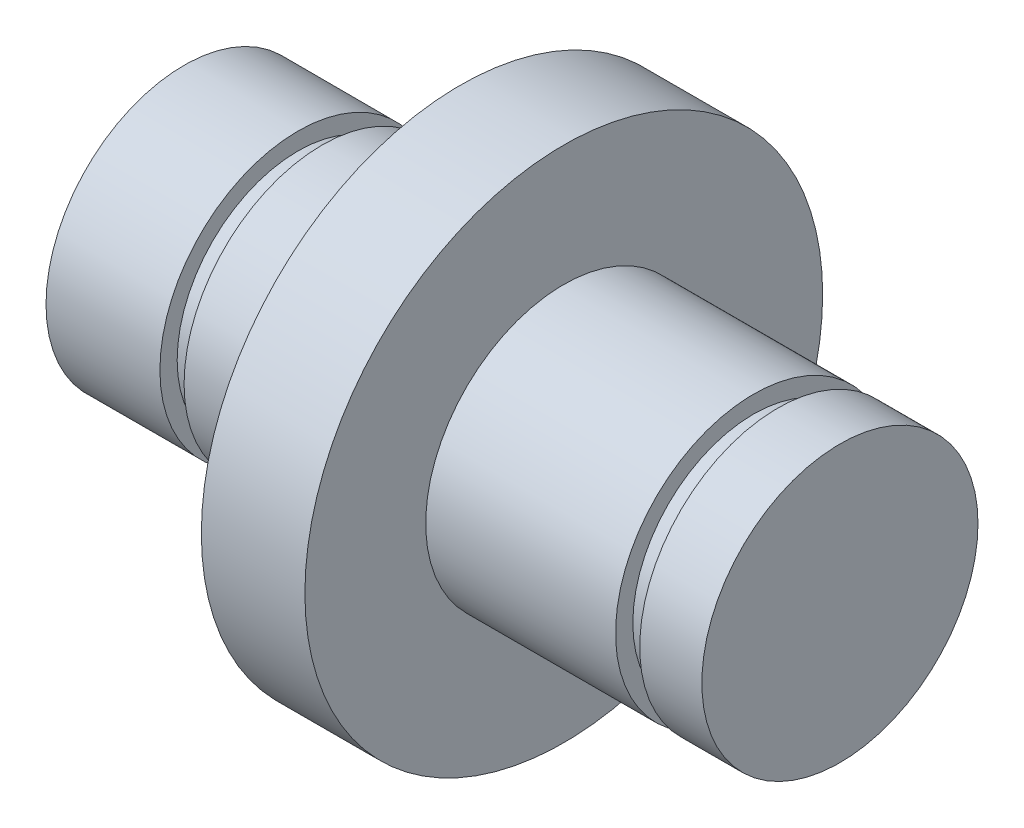
from build123d import *

# Parameters (mm, degrees)
SCHIZZO1_R                   = 7.5
ESTRUSIONE_ESTRUSIONE1_DEPTH = 9.5
SCHIZZO3_R                   = 7.5
SCHIZZO3_R_2                 = 4
TAGLIO_ESTRUSIONE1_DEPTH     = 8
TAGLIO_ESTRUSIONE2_START     = -8
SCHIZZO5_R                   = 7.5
SCHIZZO5_R_2                 = 4
TAGLIO_ESTRUSIONE2_DEPTH     = 8
SCHIZZO4_W                   = 0.7
SCHIZZO4_H                   = 0.5


with BuildPart() as part:
    # Schizzo1 → Estrusione-Estrusione1 (new, symmetric)
    with BuildSketch(Plane(origin=(0, 0, 0), x_dir=(0, 0, -1), z_dir=(1, 0, 0))):
        Circle(SCHIZZO1_R)
    extrude(amount=ESTRUSIONE_ESTRUSIONE1_DEPTH, both=True)

    # Schizzo3 → Taglio-Estrusione1 (cut)
    with BuildSketch(Plane(origin=(9.5, 0, 0), x_dir=(0, 0, -1), z_dir=(1, 0, 0))):
        Circle(SCHIZZO3_R)
        Circle(SCHIZZO3_R_2, mode=Mode.SUBTRACT)
    extrude(amount=-TAGLIO_ESTRUSIONE1_DEPTH, mode=Mode.SUBTRACT)

    # Schizzo5 → Taglio-Estrusione2 (cut)
    with BuildSketch(Plane.ZY.offset(9.5).offset(TAGLIO_ESTRUSIONE2_START)):
        Circle(SCHIZZO5_R)
        with Locations(Location((0, 0, 0), (0, 0, 180))):
            Circle(SCHIZZO5_R_2, mode=Mode.SUBTRACT)
    extrude(amount=TAGLIO_ESTRUSIONE2_DEPTH, mode=Mode.SUBTRACT)

    # Schizzo4 → Taglia-Rivoluzione1 (revolve, cut)
    with BuildSketch(Plane.XY, mode=Mode.PRIVATE) as taglia_rivoluzione1_sk:
        with Locations((7.35, 3.75)):
            Rectangle(SCHIZZO4_W, SCHIZZO4_H)
        with Locations((-5.85, 3.75)):
            Rectangle(SCHIZZO4_W, SCHIZZO4_H)
    revolve(taglia_rivoluzione1_sk.sketch.rotate(Axis((0, 0, 0), (-1, 0, 0)), 90), axis=Axis((0, 0, 0), (-1, 0, 0)), mode=Mode.SUBTRACT)


solid = part.part
